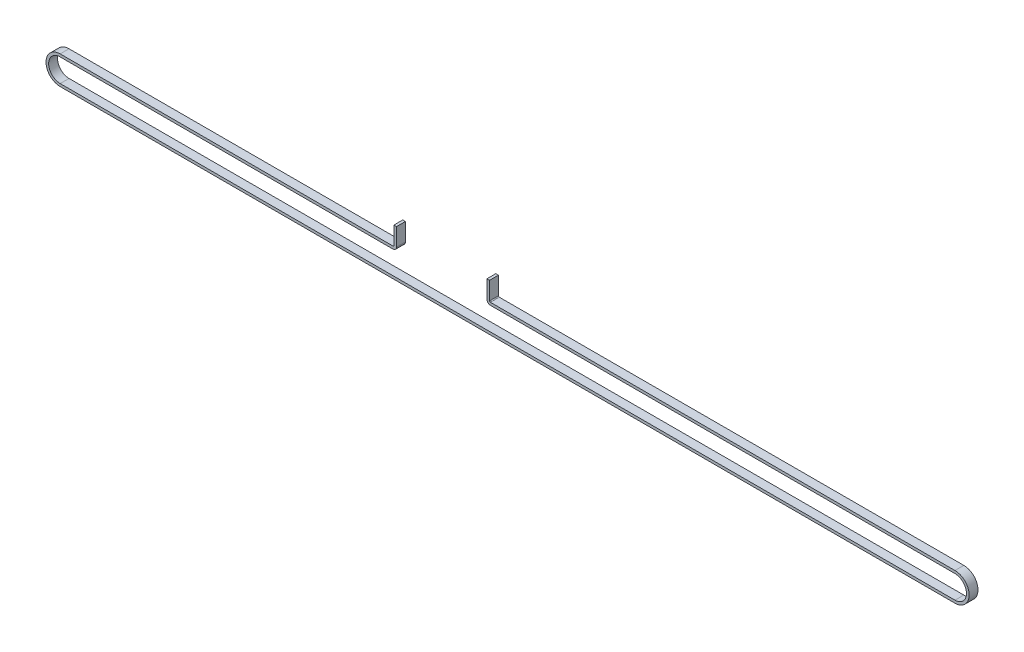
from build123d import *

# Parameters (mm, degrees)
BOSS_EXTRUDE1_DEPTH = 5


with BuildPart() as part:
    # Sketch1 → Boss-Extrude1 (new body)
    with BuildSketch(Plane.XY):
        with BuildLine():
            Line((188.33, 8.5), (188.33, 18.5))
            Line((188.33, 18.5), (189.83, 18.5))
            Line((189.83, 18.5), (189.83, 8.5))
            ThreePointArc((189.83, 8.5), (189.244213562, 7.085786438), (187.83, 6.5))
            Line((187.83, 6.5), (0, 6.5))
            ThreePointArc((0, 6.5), (-6.5, 0), (0, -6.5))
            Line((0, -6.5), (505, -6.5))
            ThreePointArc((505, -6.5), (511.5, 0), (505, 6.5))
            Line((505, 6.5), (242.83, 6.5))
            ThreePointArc((242.83, 6.5), (241.415786438, 7.085786438), (240.83, 8.5))
            Line((240.83, 8.5), (240.83, 18.5))
            Line((240.83, 18.5), (242.33, 18.5))
            Line((242.33, 18.5), (242.33, 8.5))
            ThreePointArc((242.33, 8.5), (242.476446609, 8.146446609), (242.83, 8))
            Line((242.83, 8), (505, 8))
            ThreePointArc((505, 8), (513, 0), (505, -8))
            Line((505, -8), (0, -8))
            ThreePointArc((0, -8), (-8, 0), (0, 8))
            Line((0, 8), (187.83, 8))
            ThreePointArc((187.83, 8), (188.183553391, 8.146446609), (188.33, 8.5))
        make_face()
    extrude(amount=BOSS_EXTRUDE1_DEPTH)


solid = part.part
